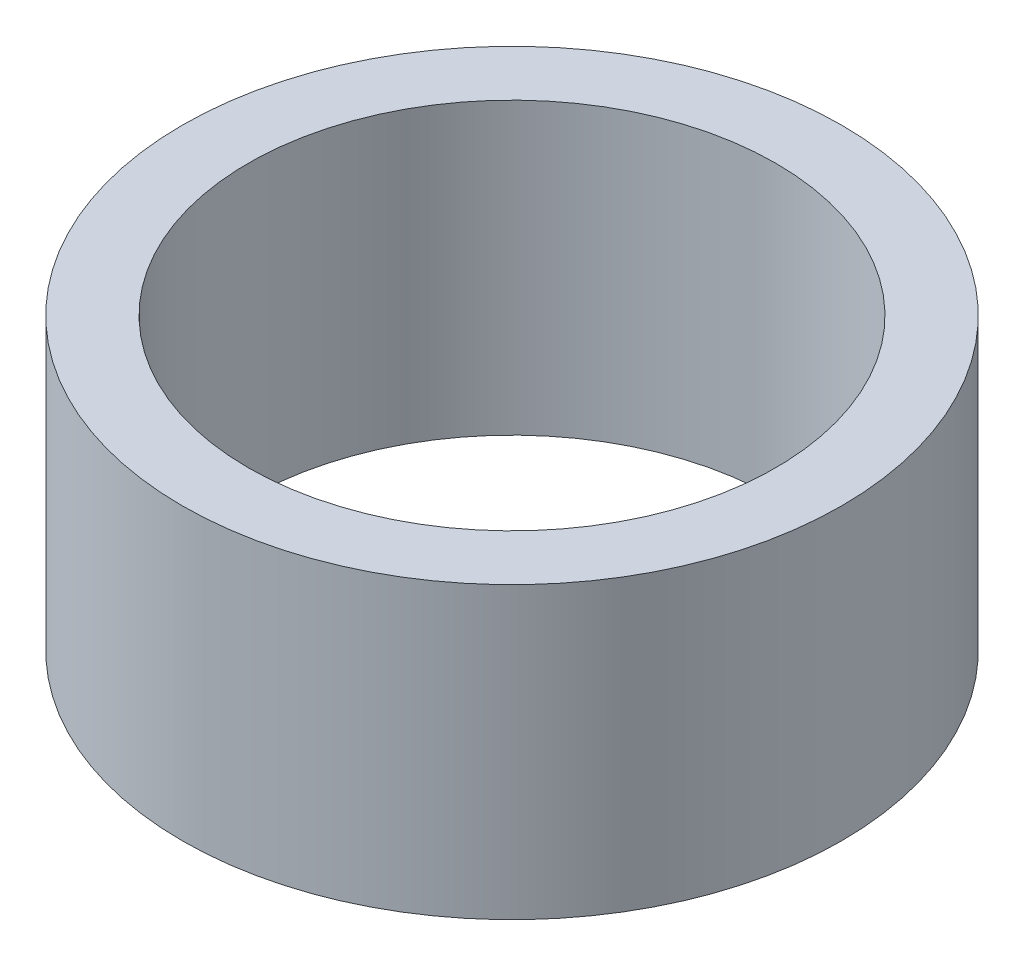
from build123d import *

# Parameters (mm, degrees)
SKETCH1_R           = 5
SKETCH1_R_2         = 4
BOSS_EXTRUDE1_DEPTH = 4.4


with BuildPart() as part:
    # Sketch1 → Boss-Extrude1 (new body)
    with BuildSketch(Plane(origin=(0, 0, 0), x_dir=(1, 0, 0), z_dir=(0, 1, 0))):
        Circle(SKETCH1_R)
        Circle(SKETCH1_R_2, mode=Mode.SUBTRACT)
    extrude(amount=-BOSS_EXTRUDE1_DEPTH)


solid = part.part
